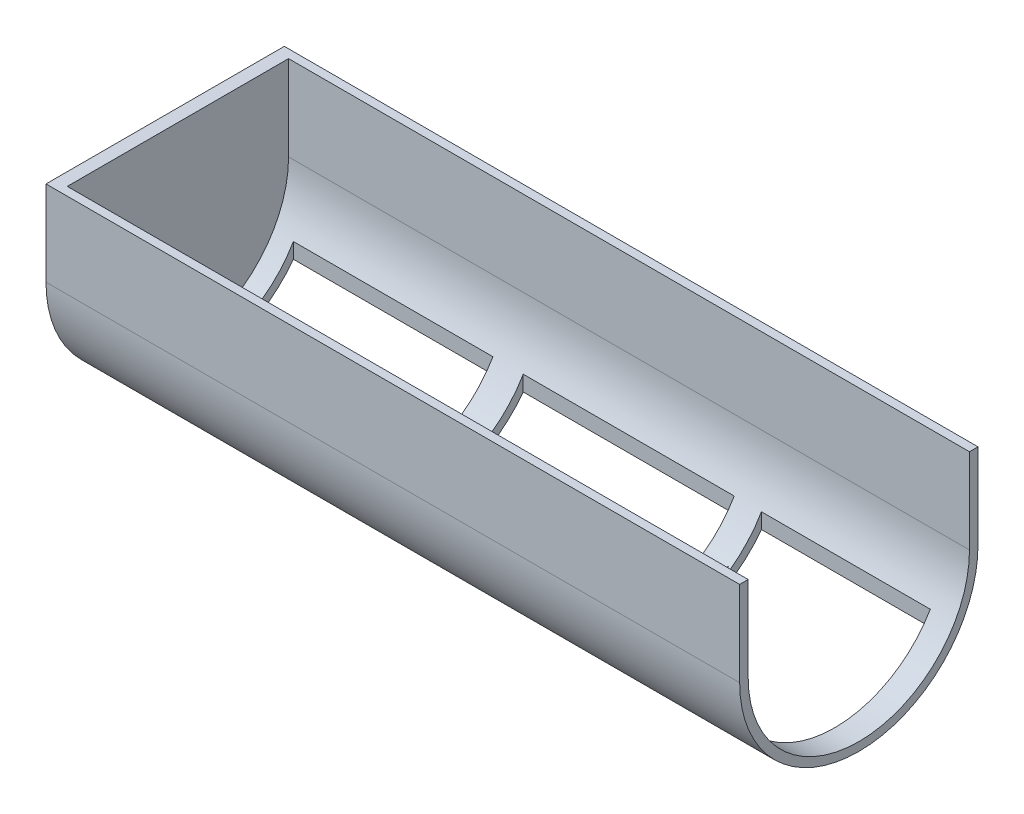
from build123d import *

# Parameters (mm, degrees)
BOSS_EXTRUDE1_DEPTH = 160
SKETCH2_W           = 160
SKETCH2_H           = 2
BOSS_EXTRUDE2_DEPTH = 20
BOSS_EXTRUDE3_START = 3
BOSS_EXTRUDE3_DEPTH = 3
SKETCH4_W           = 46.887714477
SKETCH4_H           = 41.449681409
SKETCH4_W_2         = 49.578331284
SKETCH4_H_2         = 39.698074899
SKETCH4_W_3         = 39.67361458
CUT_EXTRUDE1_DEPTH  = 170.375322878


with BuildPart() as part:
    # Sketch1 → Boss-Extrude1 (new body)
    with BuildSketch(Plane(origin=(0, 0, 0), x_dir=(0, 0, -1), z_dir=(1, 0, 0))):
        with BuildLine():
            Line((26, 0), (28, 0))
            ThreePointArc((28, 0), (0, -28), (-28, 0))
            Line((-28, 0), (-26, 0))
            ThreePointArc((-26, 0), (0, -26), (26, 0))
        make_face()
    extrude(amount=BOSS_EXTRUDE1_DEPTH)

    # Sketch2 → Boss-Extrude2 (add)
    with BuildSketch(Plane(origin=(0, 0, 0), x_dir=(1, 0, 0), z_dir=(0, 1, 0))):
        with Locations((80, 27)):
            Rectangle(SKETCH2_W, SKETCH2_H)
        with Locations((80, -27)):
            Rectangle(SKETCH2_W, SKETCH2_H)
    extrude(amount=BOSS_EXTRUDE2_DEPTH)

    # Sketch3 → Boss-Extrude3 (add)
    with BuildSketch(Plane.ZY.offset(BOSS_EXTRUDE3_START)):
        with BuildLine():
            Line((-28, 20), (28, 20))
            Line((28, 20), (28, 0))
            ThreePointArc((28, 0), (0, -28), (-28, 0))
            Line((-28, 0), (-28, 20))
        make_face()
    extrude(amount=-BOSS_EXTRUDE3_DEPTH)

    # Sketch4 → Cut-Extrude1 (cut, through all)
    with BuildSketch(Plane(origin=(0, 20, 0), x_dir=(1, 0, 0), z_dir=(0, 1, 0))):
        with Locations((28.117150866, 1.72863595)):
            Rectangle(SKETCH4_W, SKETCH4_H)
        with Locations((83.472139496, 2.604439205)):
            Rectangle(SKETCH4_W_2, SKETCH4_H_2)
        with Locations((134.499287451, 2.604439205)):
            Rectangle(SKETCH4_W_3, SKETCH4_H_2)
    extrude(amount=-CUT_EXTRUDE1_DEPTH, mode=Mode.SUBTRACT)


solid = part.part
